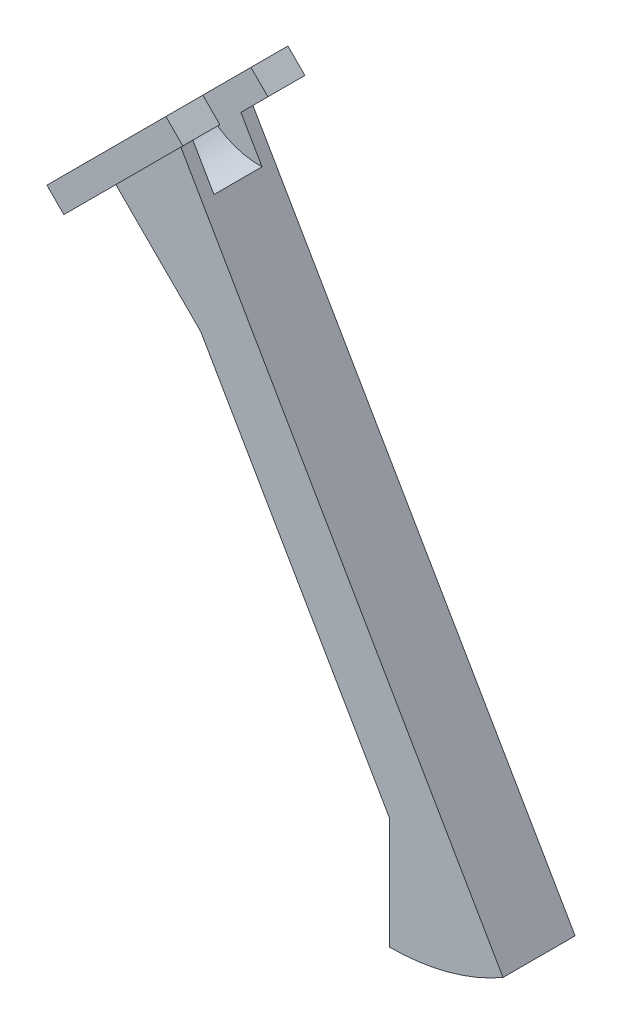
from build123d import *

# Parameters (mm, degrees)
TIBIA_RAW_DEPTH                 = 7.5
ARRONDISSEMENT_PATTE_DEPTH      = 141.261849538
ARRONDISSEMENT_PATTE_DEPTH_BACK = 141.261849538
SKETCH10_W                      = 25.4
SKETCH10_H                      = 35
BOSS_EXTRUDE3_DEPTH             = 5
SKETCH11_R                      = 15
CUT_EXTRUDE3_DEPTH              = 5
F_3_0MM_DOWEL_HOLE2_D           = 3
F_3_0MM_DOWEL_HOLE2_CSINK_D     = 3.05
F_3_0MM_DOWEL_HOLE2_CSINK_ANGLE = 90
RIB2_REACH                      = 154.986
SKETCH14_WALL_W                 = 319.8505485
SKETCH14_WALL_H                 = 5


with BuildPart() as part:
    # Sketch1 → tibia_raw (new, symmetric)
    with BuildSketch(Plane.XY):
        Polygon((-8.044335554, 0), (-8.044335554, 25), (-47.248988291, 92.904450435), (-64.926657821, 110.582119965), (-51.405330856, 124.10344693), (16.455664446, 6.564755215), align=None)
    extrude(amount=TIBIA_RAW_DEPTH, both=True)

    # Sketch4 → arrondissement_patte (cut, two sides: drawn at the far end of the back side and taken through both)
    with BuildSketch(Plane.XY.offset(-ARRONDISSEMENT_PATTE_DEPTH_BACK)):
        with BuildLine():
            ThreePointArc((4.205663462, 3.282377343), (-1.866483675, 2.074552283), (-8.044335554, 1.669634512))
            Line((-8.044335554, 1.669634512), (-8.044335554, 0))
            Line((-8.044335554, 0), (4.205663462, 3.282377343))
        make_face()
        with BuildLine():
            ThreePointArc((15.620847191, 8.010701117), (10.068210696, 5.272443864), (4.205663462, 3.282377343))
            Line((4.205663462, 3.282377343), (16.455664446, 6.564755215))
            Line((16.455664446, 6.564755215), (15.620847191, 8.010701117))
        make_face()
    extrude(amount=ARRONDISSEMENT_PATTE_DEPTH + ARRONDISSEMENT_PATTE_DEPTH_BACK, mode=Mode.SUBTRACT)

    # Sketch10 → Boss-Extrude3 (add)
    with BuildSketch(Plane(origin=(-87.754388893, 87.754388893, 0), x_dir=(0, 0, 1), z_dir=(-0.7071067811865487, 0.7071067811865465, 0))):
        with Locations((0, 41.844308868)):
            Rectangle(SKETCH10_W, SKETCH10_H)
    extrude(amount=BOSS_EXTRUDE3_DEPTH)

    # Sketch11 → Cut-Extrude3 (cut, symmetric)
    with BuildSketch(Plane.XY):
        with Locations((-47.559392621, 131.484919071)):
            Circle(SKETCH11_R)
    extrude(amount=CUT_EXTRUDE3_DEPTH, both=True, mode=Mode.SUBTRACT)

    # Ø3.0mm Dowel Hole2 (through all)
    with Locations(Plane(origin=(-91.289922799, 91.289922799, 0), x_dir=(0, 0, 1), z_dir=(-0.7071067811865488, 0.7071067811865464, 0))):
        with Locations((-9.525, 55.314308868), (9.525, 55.314308868), (9.525, 28.374308868), (-9.525, 28.374308868)):
            CounterSinkHole(F_3_0MM_DOWEL_HOLE2_D / 2, F_3_0MM_DOWEL_HOLE2_CSINK_D / 2, counter_sink_angle=F_3_0MM_DOWEL_HOLE2_CSINK_ANGLE)

    # Sketch14 wall → Rib2 (add, up to next)
    with BuildSketch(Plane(origin=(-63.389537203, 104.845507721, 0), x_dir=(0.965925826292, -0.258819045091, 0), z_dir=(0.258819045091, 0.965925826292, 0)), mode=Mode.PRIVATE) as rib2_sk1:
        Rectangle(SKETCH14_WALL_W, SKETCH14_WALL_H)
    rib2_tool1 = extrude(rib2_sk1.sketch, amount=RIB2_REACH, mode=Mode.PRIVATE) - part.part
    add(rib2_tool1.solids().sort_by_distance((-63.389537203, 104.845507721, 0))[0])


solid = part.part
